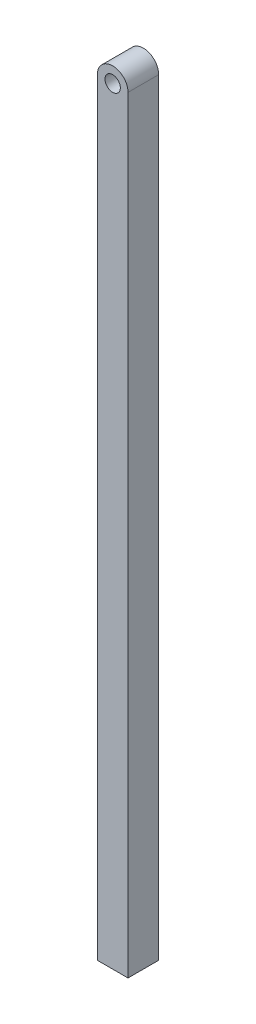
from build123d import *

# Parameters (mm, degrees)
SKETCH1_R           = 6.35
BOSS_EXTRUDE1_DEPTH = 25.4


with BuildPart() as part:
    # Sketch1 → Boss-Extrude1 (new body)
    with BuildSketch(Plane.XY):
        with BuildLine():
            Line((-12.7, 0), (-12.7, -635))
            Line((-12.7, -635), (12.7, -635))
            Line((12.7, -635), (12.7, 0))
            ThreePointArc((12.7, 0), (0, 12.7), (-12.7, 0))
        make_face()
        Circle(SKETCH1_R, mode=Mode.SUBTRACT)
    extrude(amount=BOSS_EXTRUDE1_DEPTH)


solid = part.part
